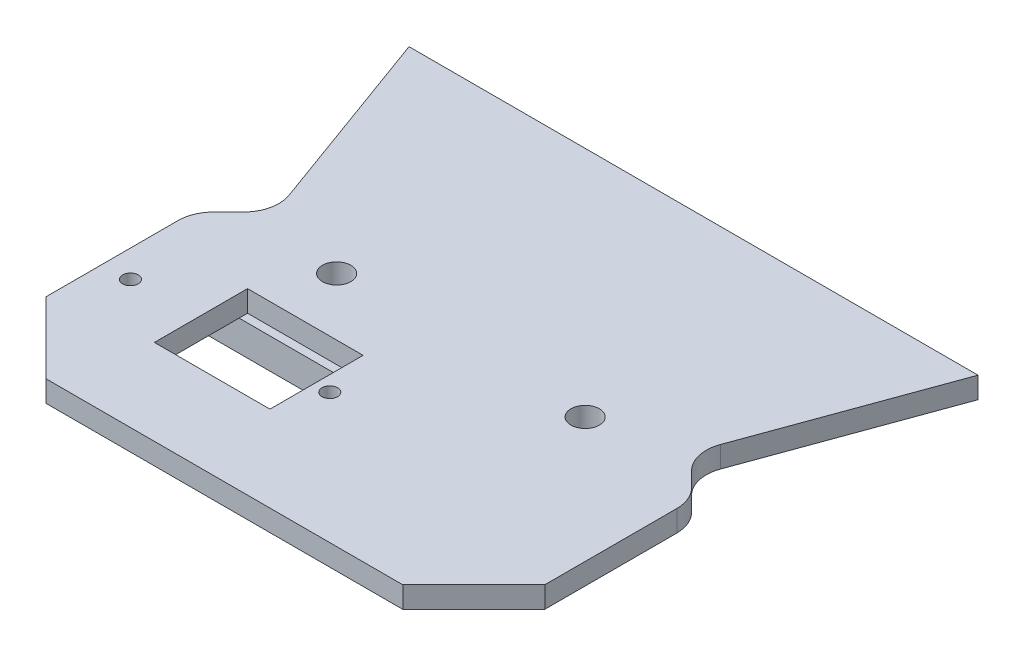
from build123d import *

# Parameters (mm, degrees)
BOSS_EXTRUDE1_DEPTH = 3
SKETCH2_R           = 2
BOSS_EXTRUDE2_DEPTH = 10
SKETCH3_R           = 1.1
CUT_EXTRUDE1_DEPTH  = 10
SKETCH4_W           = 26.4
SKETCH4_H           = 15.8
SKETCH4_W_2         = 22.4
SKETCH4_H_2         = 11.8
BOSS_EXTRUDE3_DEPTH = 4.3
BOSS_EXTRUDE4_DEPTH = 4.3
SKETCH6_R           = 1.1
CUT_EXTRUDE2_DEPTH  = 20.3
SKETCH7_W           = 16.276669309
SKETCH7_H           = 13.12120508
CUT_EXTRUDE3_DEPTH  = 20.3
BOSS_EXTRUDE5_DEPTH = 3
CUT_EXTRUDE4_START  = -21
SKETCH10_R          = 2
CUT_EXTRUDE4_DEPTH  = 21


with BuildPart() as part:
    # Sketch1 → Boss-Extrude1 (new body)
    with BuildSketch(Plane(origin=(0, 0, 0), x_dir=(1, 0, 0), z_dir=(0, 1, 0))):
        with BuildLine():
            Line((-30.38926404, 6.174917902), (-40.065448474, 32.76001614))
            Line((-40.065448474, 32.76001614), (40.065448474, 32.76001614))
            Line((40.065448474, 32.76001614), (30.38926404, 6.174917902))
            ThreePointArc((30.38926404, 6.174917902), (30.206247108, 3.382619115), (31.552193238, 0.929283279))
            Line((31.552193238, 0.929283279), (33.658129878, -1.17665336))
            ThreePointArc((33.658129878, -1.17665336), (34.741993634, -2.798770105), (35.122595972, -4.712187266))
            Line((35.122595972, -4.712187266), (35.122595972, -23.310725409))
            Line((35.122595972, -23.310725409), (-35.122595972, -23.310725409))
            Line((-35.122595972, -23.310725409), (-35.122595972, -4.712187266))
            ThreePointArc((-35.122595972, -4.712187266), (-34.741993634, -2.798770105), (-33.658129878, -1.17665336))
            Line((-33.658129878, -1.17665336), (-31.552193238, 0.929283279))
            ThreePointArc((-31.552193238, 0.929283279), (-30.206247108, 3.382619115), (-30.38926404, 6.174917902))
        make_face()
    extrude(amount=BOSS_EXTRUDE1_DEPTH)

    # Sketch2 → Boss-Extrude2 (add)
    with BuildSketch(Plane(origin=(0, 3, 0), x_dir=(1, 0, 0), z_dir=(0, 1, 0))):
        with Locations(Location((17.5, 0, 0), (0, 0, 270))):
            Circle(SKETCH2_R)
        with Locations(Location((-17.5, 0, 0), (0, 0, 270))):
            Circle(SKETCH2_R)
    extrude(amount=BOSS_EXTRUDE2_DEPTH)

    # Sketch3 → Cut-Extrude1 (cut)
    with BuildSketch(Plane(origin=(0, 3, 0), x_dir=(1, 0, 0), z_dir=(0, 1, 0))):
        with Locations(Location((-31.300794494, -15.24150981, 0), (0, 0, 270))):
            Circle(SKETCH3_R)
        with Locations(Location((-3.502149082, -14.967077195, 0), (0, 0, 270))):
            Circle(SKETCH3_R)
    extrude(amount=-CUT_EXTRUDE1_DEPTH, mode=Mode.SUBTRACT)

    # Sketch4 → Boss-Extrude3 (add)
    with BuildSketch(Plane.XZ):
        with Locations((-17.401471788, 15.214861671)):
            Rectangle(SKETCH4_W, SKETCH4_H)
        with Locations((-17.401471788, 15.214861671)):
            Rectangle(SKETCH4_W_2, SKETCH4_H_2, mode=Mode.SUBTRACT)
    extrude(amount=BOSS_EXTRUDE3_DEPTH)

    # Sketch5 → Boss-Extrude4 (add)
    with BuildSketch(Plane.XZ):
        Polygon((-30.601471788, 23.114861671), (-30.601471788, 7.314861671), (-33.601471788, 9.046912478), (-33.601471788, 21.382810863), align=None)
        Polygon((-1.201471788, 21.382810863), (-4.201471788, 23.114861671), (-4.201471788, 7.314861671), (-1.201471788, 9.046912478), align=None)
    extrude(amount=BOSS_EXTRUDE4_DEPTH)

    # Sketch6 → Cut-Extrude2 (cut)
    with BuildSketch(Plane(origin=(0, 3, 0), x_dir=(1, 0, 0), z_dir=(0, 1, 0))):
        with Locations(Location((-31.300794494, -15.24150981, 0), (0, 0, 270))):
            Circle(SKETCH6_R)
        with Locations(Location((-3.502149082, -14.967077195, 0), (0, 0, 270))):
            Circle(SKETCH6_R)
    extrude(amount=-CUT_EXTRUDE2_DEPTH, mode=Mode.SUBTRACT)

    # Sketch7 → Cut-Extrude3 (cut)
    with BuildSketch(Plane.XZ):
        with Locations((-13.786077898, 14.682620826)):
            Rectangle(SKETCH7_W, SKETCH7_H)
    extrude(amount=-CUT_EXTRUDE3_DEPTH, mode=Mode.SUBTRACT)

    # Sketch8 → Boss-Extrude5 (add)
    with BuildSketch(Plane(origin=(0, 3, 0), x_dir=(1, 0, 0), z_dir=(0, 1, 0))):
        Polygon((-35.122595972, -23.310725409), (35.122595972, -23.310725409), (25.122595972, -33.310725409), (-25.122595972, -33.310725409), align=None)
    extrude(amount=-BOSS_EXTRUDE5_DEPTH)

    # Sketch10 → Cut-Extrude4 (cut)
    with BuildSketch(Plane(origin=(0, 13, 0), x_dir=(1, 0, 0), z_dir=(0, 1, 0)).offset(CUT_EXTRUDE4_START)):
        with Locations(Location((-17.5, 0, 0), (0, 0, 270))):
            Circle(SKETCH10_R)
        with Locations(Location((17.5, 0, 0), (0, 0, 270))):
            Circle(SKETCH10_R)
    extrude(amount=CUT_EXTRUDE4_DEPTH, mode=Mode.SUBTRACT)


solid = part.part
